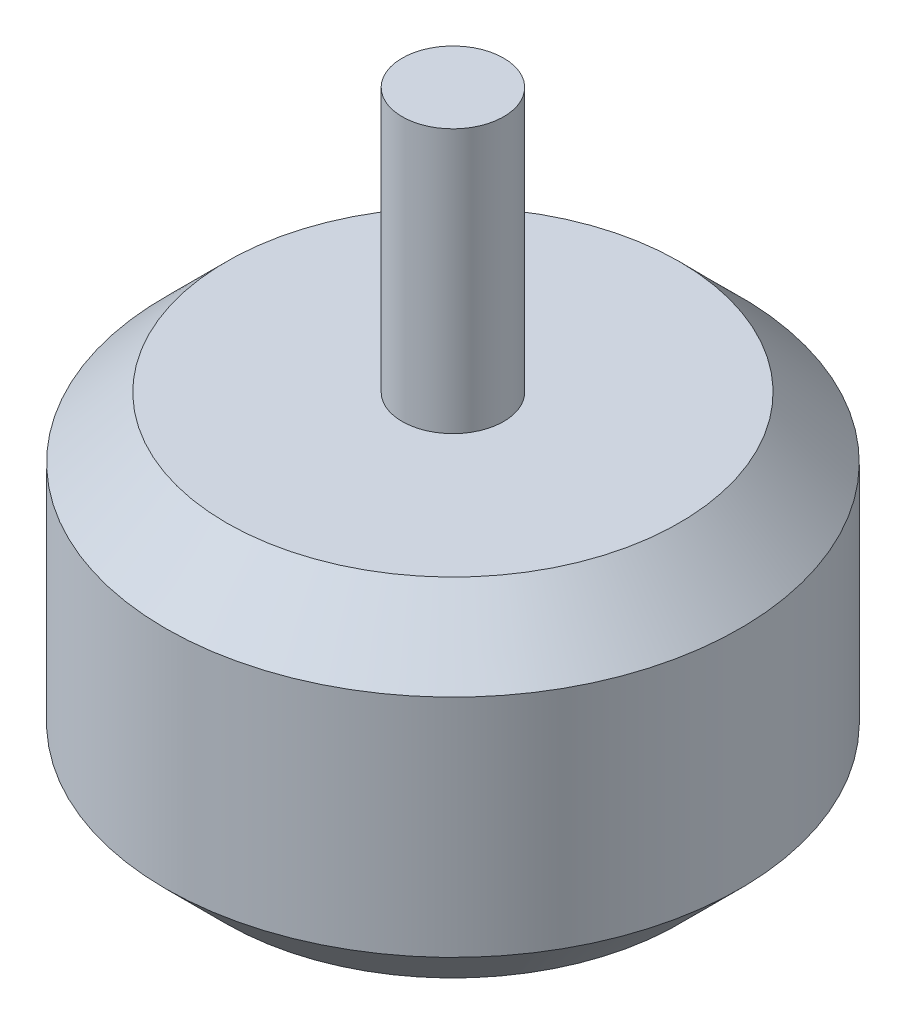
from build123d import *

# Parameters (mm, degrees)
SKETCH_1_R          = 14.15
EXTRUDE_1_DEPTH     = 17.1
SKETCH_2_R          = 2.5
EXTRUDE_2_DEPTH     = 13
CHAMFER_1_SIZE      = 3
SKETCH_3_R          = 1.5
CUT_EXTRUDE_1_DEPTH = 4
EXTRUDE_START       = 2
SKETCH_4_R          = 2.5
EXTRUDE_3_DEPTH     = 2


with BuildPart() as part:
    # 草图1 → 凸台-拉伸1 (new body)
    with BuildSketch(Plane(origin=(0, 0, 0), x_dir=(1, 0, 0), z_dir=(0, 1, 0))):
        with Locations(Location((0, 0, 0), (0, 0, 270))):
            Circle(SKETCH_1_R)
    extrude(amount=EXTRUDE_1_DEPTH)

    # 草图2 → 凸台-拉伸2 (add)
    with BuildSketch(Plane(origin=(0, 17.1, 0), x_dir=(1, 0, 0), z_dir=(0, 1, 0))):
        with Locations(Location((0, 0, 0), (0, 0, 90))):
            Circle(SKETCH_2_R)
    extrude(amount=EXTRUDE_2_DEPTH)

    # 倒角1
    chamfer_1_edges = [part.edges().sort_by_distance(p)[0] for p in [
        (0, 0, -14.15),
        (0, 17.1, -14.15),
    ]]
    chamfer(chamfer_1_edges, length=CHAMFER_1_SIZE)

    # 草图3 → 切除-拉伸1 (cut)
    with BuildSketch(Plane.XZ):
        with Locations(Location((-8, 0, 0), (0, 0, 270))):
            Circle(SKETCH_3_R)
        with Locations(Location((0, 8, 0), (0, 0, 270))):
            Circle(SKETCH_3_R)
        with Locations(Location((8, 0, 0), (0, 0, 90))):
            Circle(SKETCH_3_R)
        with Locations(Location((0, -8, 0), (0, 0, 90))):
            Circle(SKETCH_3_R)
    extrude(amount=-CUT_EXTRUDE_1_DEPTH, mode=Mode.SUBTRACT)

    # 草图4 → 凸台-拉伸3 (add)
    with BuildSketch(Plane.XZ.offset(EXTRUDE_START)):
        with Locations(Location((0, 0, 0), (0, 0, 270))):
            Circle(SKETCH_4_R)
    extrude(amount=-EXTRUDE_3_DEPTH)


solid = part.part
